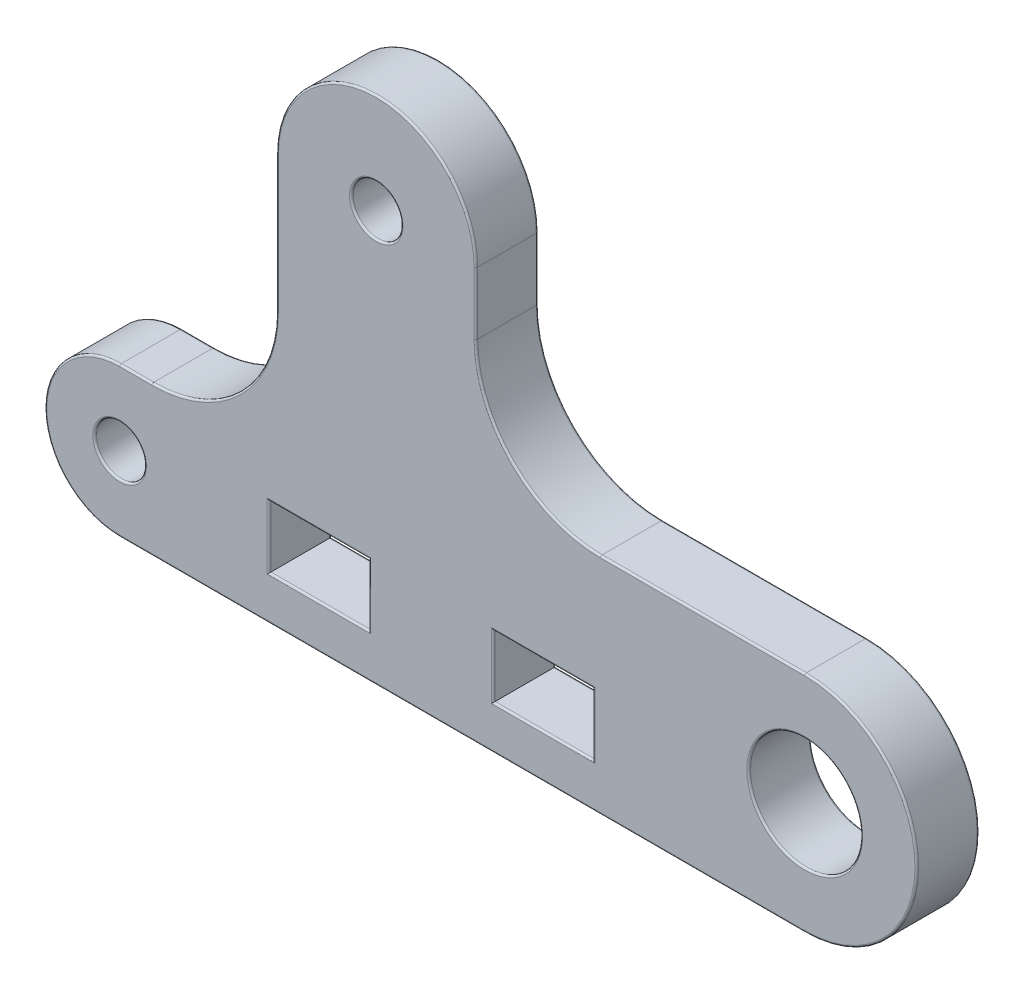
from build123d import *

# Parameters (mm, degrees)
SKETCH1_R           = 2
SKETCH1_R_2         = 4.5
SKETCH1_W           = 8
SKETCH1_H           = 5
BOSS_EXTRUDE1_DEPTH = 5
FILLET1_R           = 0.15


with BuildPart() as part:
    # Sketch1 → Boss-Extrude1 (new body)
    with BuildSketch(Plane.XY):
        with BuildLine():
            Line((-27.5, 0), (27.5, 0))
            ThreePointArc((27.5, 0), (36.5, 9), (27.5, 18))
            Line((27.5, 18), (11.1, 18))
            ThreePointArc((11.1, 18), (4.028932188, 20.928932188), (1.1, 28))
            Line((1.1, 28), (1.1, 33))
            ThreePointArc((1.1, 33), (-6.9, 41), (-14.9, 33))
            Line((-14.9, 33), (-14.9, 22))
            ThreePointArc((-14.9, 22), (-17.828932188, 14.928932188), (-24.9, 12))
            Line((-24.9, 12), (-27.5, 12))
            ThreePointArc((-27.5, 12), (-33.5, 6), (-27.5, 0))
        make_face()
        with Locations((-27.5, 6)):
            Circle(SKETCH1_R, mode=Mode.SUBTRACT)
        with Locations((27.5, 9)):
            Circle(SKETCH1_R_2, mode=Mode.SUBTRACT)
        with Locations((-6.9, 33)):
            Circle(SKETCH1_R, mode=Mode.SUBTRACT)
        with Locations((-11.5, 6)):
            Rectangle(SKETCH1_W, SKETCH1_H, mode=Mode.SUBTRACT)
        with Locations((6.5, 6)):
            Rectangle(SKETCH1_W, SKETCH1_H, mode=Mode.SUBTRACT)
    extrude(amount=BOSS_EXTRUDE1_DEPTH)

    # Fillet1
    fillet1_edges = [part.edges().sort_by_distance(p)[0] for p in [
        (-26.2, 12, 0),
        (-17.828932188, 14.928932188, 0),
        (-14.9, 27.5, 0),
        (-6.9, 41, 0),
        (1.1, 30.5, 0),
        (4.028932188, 20.928932188, 0),
        (19.3, 18, 0),
        (36.5, 9, 5),
        (36.5, 9, 0),
        (0, 0, 0),
        (-33.5, 6, 0),
        (19.3, 18, 5),
        (4.028932188, 20.928932188, 5),
        (1.1, 30.5, 5),
        (23, 9, 0),
        (23, 9, 5),
        (-6.9, 41, 5),
        (-8.9, 33, 0),
        (-8.9, 33, 5),
        (-14.9, 27.5, 5),
        (-29.5, 6, 0),
        (-29.5, 6, 5),
        (-17.828932188, 14.928932188, 5),
        (-15.5, 6, 0),
        (-11.5, 3.5, 0),
        (-26.2, 12, 5),
        (-7.5, 6, 0),
        (-11.5, 8.5, 0),
        (-15.5, 6, 5),
        (-11.5, 3.5, 5),
        (-7.5, 6, 5),
        (-11.5, 8.5, 5),
        (-33.5, 6, 5),
        (2.5, 6, 0),
        (6.5, 3.5, 0),
        (10.5, 6, 0),
        (6.5, 8.5, 0),
        (2.5, 6, 5),
        (6.5, 3.5, 5),
        (10.5, 6, 5),
        (6.5, 8.5, 5),
        (0, 0, 5),
    ]]
    fillet(fillet1_edges, radius=FILLET1_R)


solid = part.part
